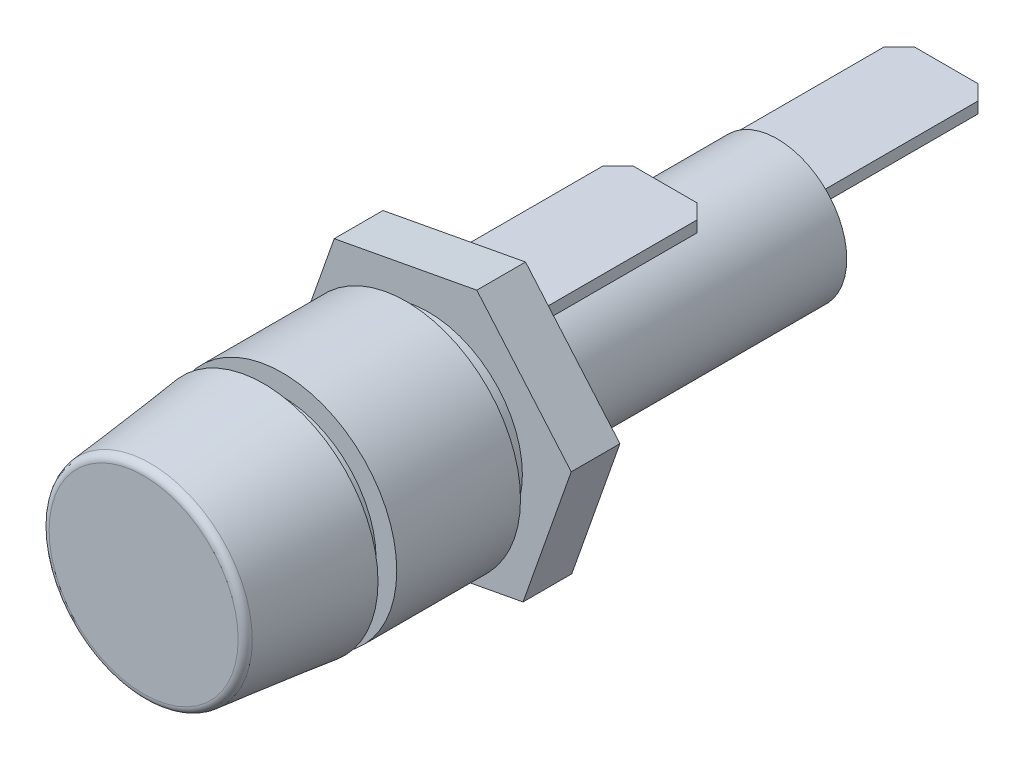
from build123d import *

# Parameters (mm, degrees)
BOSS_EXTRUDE1_DEPTH = 3.302
FILLET1_R           = 0.508
SKETCH3_W           = 6.35
SKETCH3_H           = 0.762
BOSS_EXTRUDE2_DEPTH = 11.43
SKETCH4_W           = 6.35
SKETCH4_H           = 0.762
BOSS_EXTRUDE3_DEPTH = 11.43
CHAMFER1_SIZE       = 1.016


with BuildPart() as part:
    # Sketch1 → Base-Revolve (revolve)
    with BuildSketch(Plane(origin=(0, 0, 0), x_dir=(1, 0, 0), z_dir=(0, 1, 0))):
        Polygon((0, -17.78), (6.858, -17.78), (7.747, -9.652), (6.35, -9.652), (6.35, -8.382), (7.747, -8.382), (7.747, 0), (6.35, 0), (6.35, 6.096), (4.699, 6.096), (4.699, 25.146), (0, 25.146), align=None)
    revolve(axis=Axis((0, 0, 0), (0, 0, -1)))

    # Sketch2 → Boss-Extrude1 (add)
    with BuildSketch(Plane(origin=(0, 0, -4.826), x_dir=(-1, 0, 0), z_dir=(0, 0, -1))):
        Polygon((-6.394250991, -7.45995949), (3.263388934, -9.267563542), (9.657639925, -1.807604052), (6.394250991, 7.45995949), (-3.263388934, 9.267563542), (-9.657639925, 1.807604052), align=None)
    extrude(amount=-BOSS_EXTRUDE1_DEPTH)

    # Fillet1
    fillet1_edges = [part.edges().sort_by_distance(p)[0] for p in [
        (-6.858, 0, 17.78),
    ]]
    fillet(fillet1_edges, radius=FILLET1_R)

    # Sketch3 → Boss-Extrude2 (add)
    with BuildSketch(Plane(origin=(0, 0, -25.146), x_dir=(-1, 0, 0), z_dir=(0, 0, -1))):
        with Locations((0, 2.921)):
            Rectangle(SKETCH3_W, SKETCH3_H)
    extrude(amount=BOSS_EXTRUDE2_DEPTH)

    # Sketch4 → Boss-Extrude3 (add)
    with BuildSketch(Plane(origin=(-0.217554927, 1.748253857, -6.096), x_dir=(-1, 0, 0), z_dir=(0, 0, -1))):
        with Locations((-0.217554927, 3.712746143)):
            Rectangle(SKETCH4_W, SKETCH4_H)
    extrude(amount=BOSS_EXTRUDE3_DEPTH)

    # Chamfer1
    chamfer1_edges = [part.edges().sort_by_distance(p)[0] for p in [
        (3.175, 5.461, -17.526),
        (-3.175, 5.461, -17.526),
        (-3.175, 2.921, -36.576),
        (3.175, 2.921, -36.576),
    ]]
    chamfer(chamfer1_edges, length=CHAMFER1_SIZE)


solid = part.part
